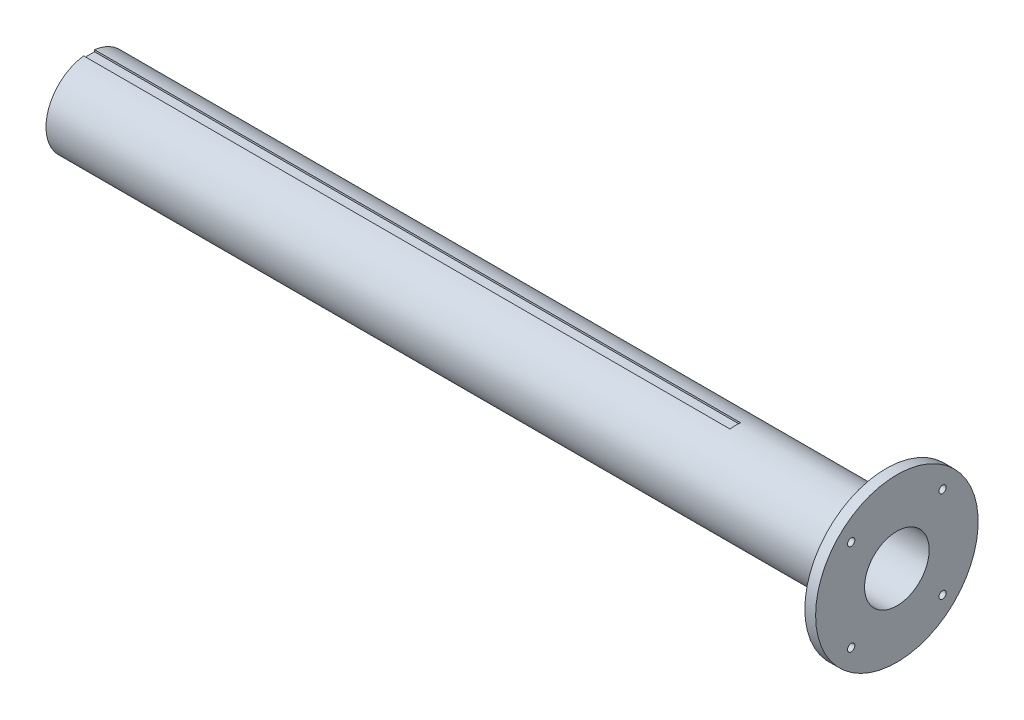
from build123d import *

# Parameters (mm, degrees)
SKETCH2_W             = 10
SKETCH2_H             = 4
EXTRUDE1_DEPTH        = 600
M8_TAPPED_HOLE1_D     = 6.8
M8_TAPPED_HOLE1_DEPTH = 19.75
M8_TAPPED_HOLE1_TIP   = 2.042926105


with BuildPart() as part:
    # Sketch1 → Revolve1 (revolve)
    with BuildSketch(Plane.XY, mode=Mode.PRIVATE) as revolve1_sk:
        Polygon((-108.27123445, 10), (-108.27123445, 0), (631.72876555, 0), (631.72876555, -35.462555066), (641.72876555, -35.462555066), (641.72876555, 10), align=None)
    revolve(revolve1_sk.sketch.rotate(Axis((-148.45814978, 40, 0), (1, 0, 0)), 270), axis=Axis((-148.45814978, 40, 0), (1, 0, 0)))

    # Sketch2 → Extrude1 (cut)
    with BuildSketch(Plane.ZY.offset(108.27123445)):
        with Locations((0, 80)):
            Rectangle(SKETCH2_W, SKETCH2_H)
    extrude(amount=-EXTRUDE1_DEPTH, mode=Mode.SUBTRACT)

    # M8 Tapped Hole1
    with Locations(Plane(origin=(641.72876555, 82.426406871, 42.426406871), x_dir=(0, 0, 1), z_dir=(1, 0, 0))):
        with Locations((0, 0), (-84.852813742, 0), (-84.852813742, 84.852813742), (0, 84.852813742)):
            Hole(M8_TAPPED_HOLE1_D / 2, depth=M8_TAPPED_HOLE1_DEPTH)
            with Locations((0, 0, -(M8_TAPPED_HOLE1_DEPTH + M8_TAPPED_HOLE1_TIP / 2))):  # 118° drill point
                Cone(0, M8_TAPPED_HOLE1_D / 2, M8_TAPPED_HOLE1_TIP, mode=Mode.SUBTRACT)


solid = part.part
